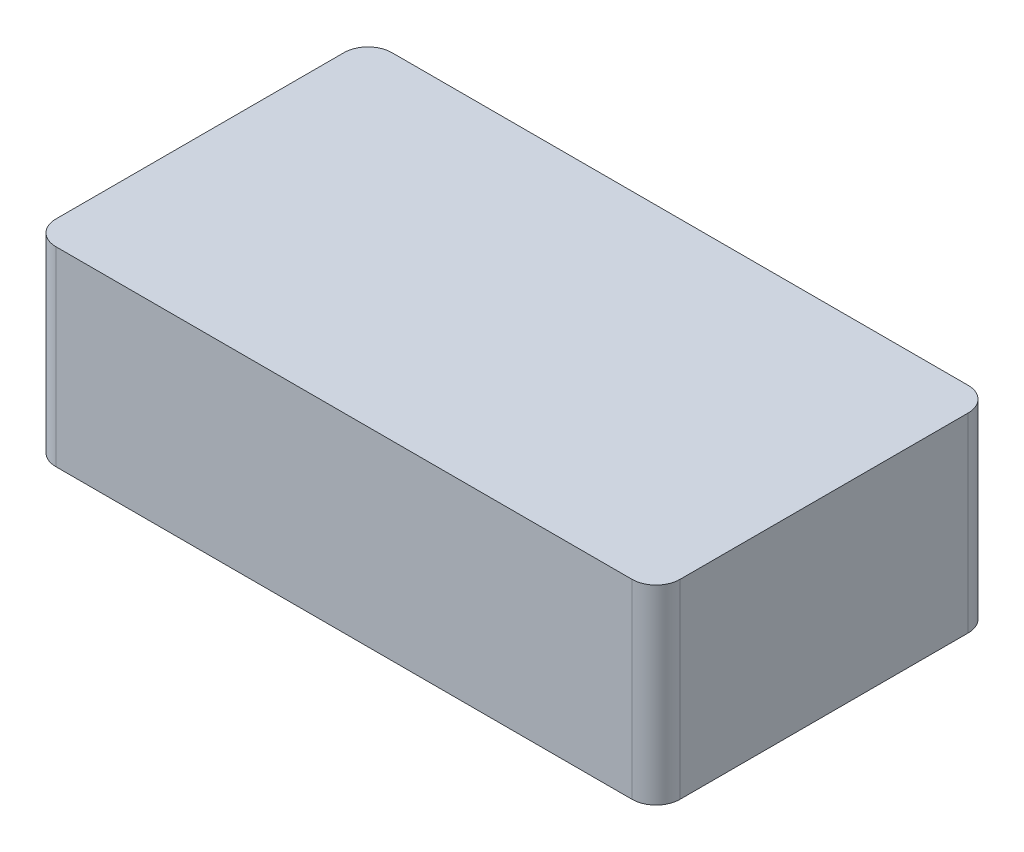
from build123d import *

# Parameters (mm, degrees)
SKETCH1_W           = 6.5
SKETCH1_H           = 3.5
BOSS_EXTRUDE1_DEPTH = 1.984375
FILLET1_R           = 0.25
FILLET2_R           = 0.25


with BuildPart() as part:
    # Sketch1 → Boss-Extrude1 (new body)
    with BuildSketch(Plane(origin=(0, 0, 0), x_dir=(1, 0, 0), z_dir=(0, 1, 0))):
        with Locations((3.25, 1.75)):
            Rectangle(SKETCH1_W, SKETCH1_H)
    extrude(amount=BOSS_EXTRUDE1_DEPTH)

    # Fillet1
    fillet1_edges = [part.edges().sort_by_distance(p)[0] for p in [
        (6.5, 0.9921875, 0),
        (0, 0.9921875, 0),
    ]]
    fillet(fillet1_edges, radius=FILLET1_R)

    # Fillet2
    fillet2_edges = [part.edges().sort_by_distance(p)[0] for p in [
        (0, 0.9921875, -3.5),
        (6.5, 0.9921875, -3.5),
    ]]
    fillet(fillet2_edges, radius=FILLET2_R)


solid = part.part
